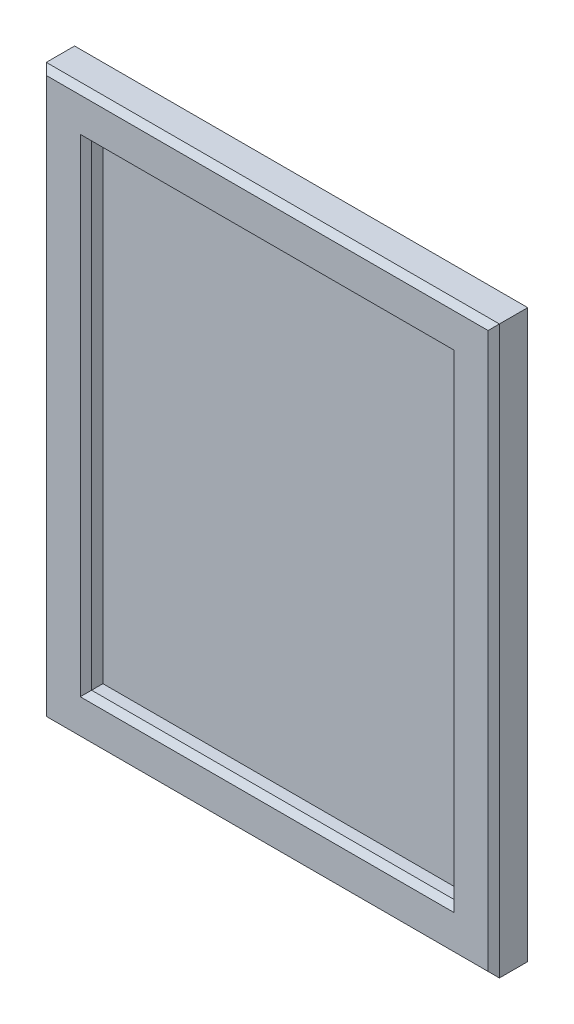
from build123d import *

# Parameters (mm, degrees)
SKETCH_1_W      = 800
SKETCH_1_H      = 1000
SKETCH_1_W_2    = 640
SKETCH_1_H_2    = 840
EXTRUDE_1_DEPTH = 60
CHAMFER_1_SIZE  = 10
EXTRUDE_START   = -20
SKETCH_2_W      = 695.449967655
SKETCH_2_H      = 915.943493932
EXTRUDE_2_DEPTH = 10


with BuildPart() as part:
    # Эскиз1 → Бобышка-Вытянуть1 (new body)
    with BuildSketch(Plane.XY):
        with Locations((400, 500)):
            Rectangle(SKETCH_1_W, SKETCH_1_H)
        with Locations((400, 500)):
            Rectangle(SKETCH_1_W_2, SKETCH_1_H_2, mode=Mode.SUBTRACT)
    extrude(amount=EXTRUDE_1_DEPTH)

    # Фаска1
    chamfer_1_edges = [part.edges().sort_by_distance(p)[0] for p in [
        (800, 500, 60),
        (400, 80, 60),
        (400, 1000, 60),
        (720, 500, 60),
        (400, 920, 60),
        (80, 500, 60),
        (0, 500, 60),
        (400, 0, 60),
    ]]
    chamfer(chamfer_1_edges, length=CHAMFER_1_SIZE)


with BuildPart() as body_2:
    # Эскиз2 → Бобышка-Вытянуть2 (new body)
    with BuildSketch(Plane(origin=(0, 0, 0), x_dir=(-1, 0, 0), z_dir=(0, 0, -1)).offset(EXTRUDE_START)):
        with Locations((-389.584727631, 495.485128436)):
            Rectangle(SKETCH_2_W, SKETCH_2_H)
    extrude(amount=-EXTRUDE_2_DEPTH)


solid = Compound([part.part, body_2.part])
